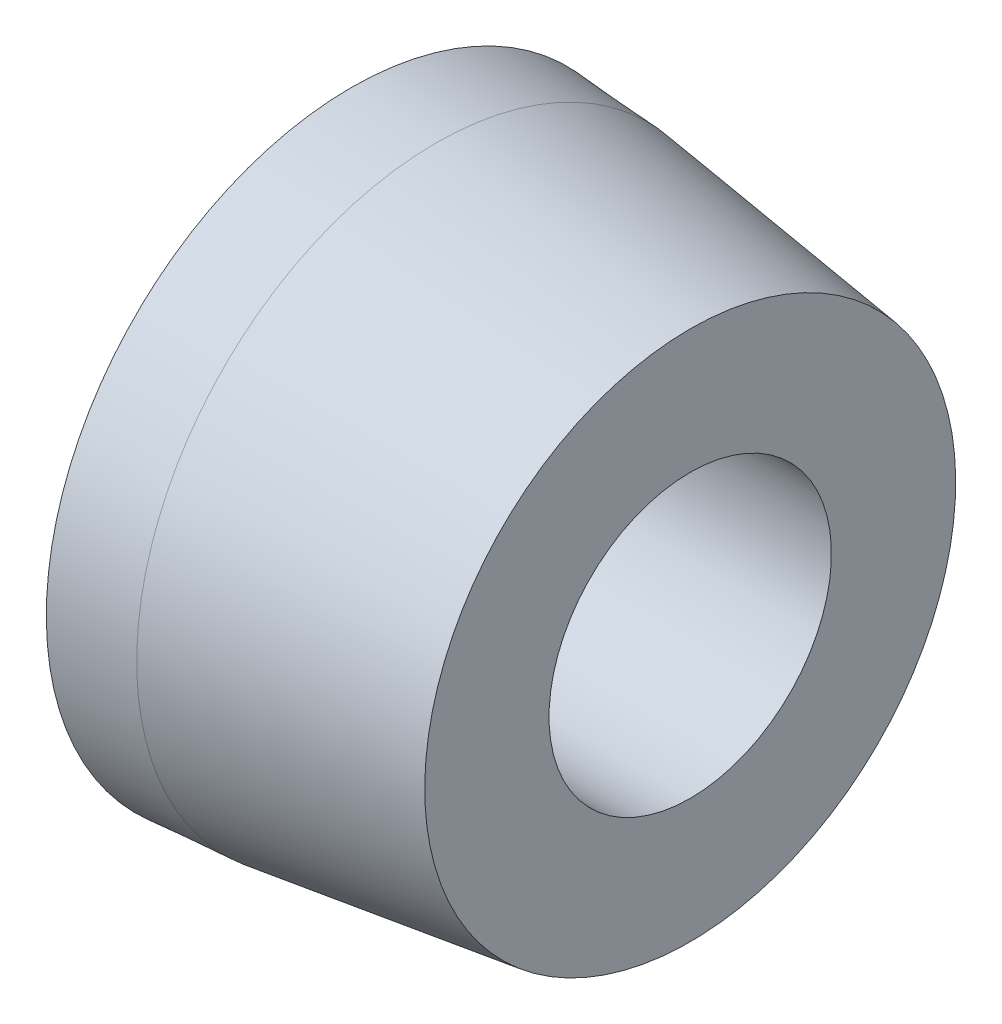
from build123d import *

# Parameters (mm, degrees)
REVOLVE1_ANGLE = 359.999999589


with BuildPart() as part:
    # Sketch1 → Revolve1 (revolve)
    with BuildSketch(Plane.XY):
        Polygon((1250, 250), (1250, 540), (1400, 530), (1550, 510), (1700, 490), (1850, 470), (1850, 250), align=None)
    revolve(axis=Axis((0, 0, 0), (1, 0, 0)), revolution_arc=REVOLVE1_ANGLE)


solid = part.part
